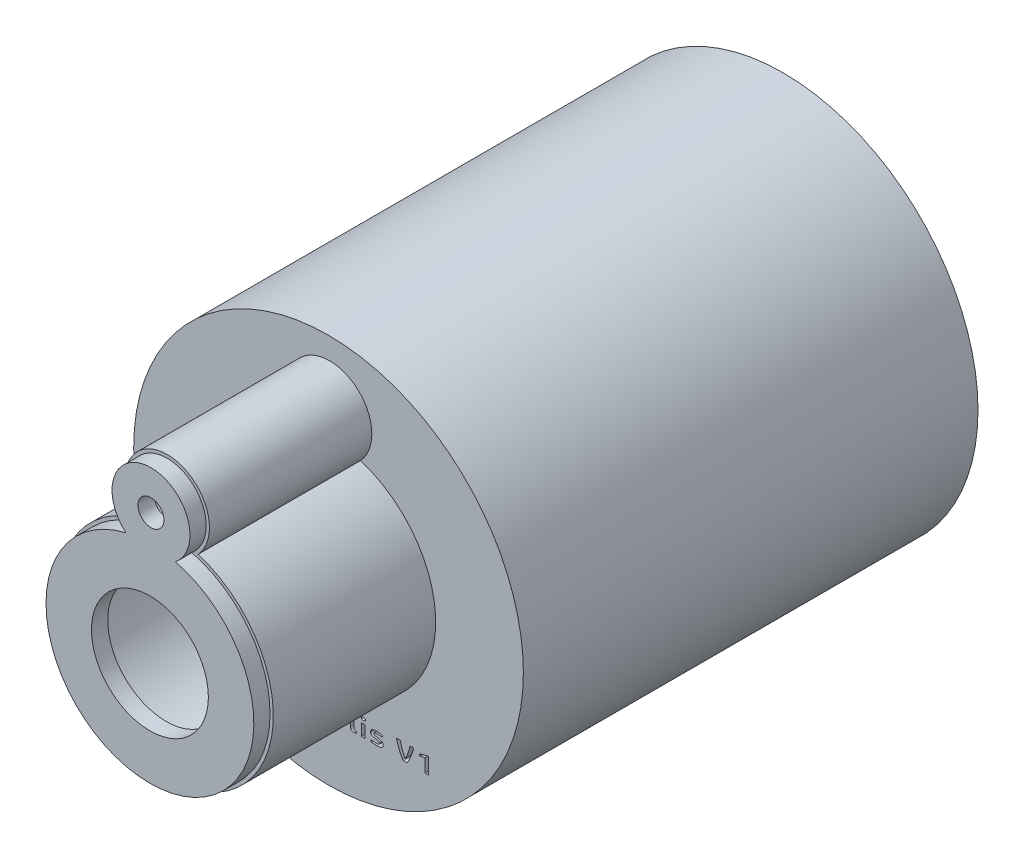
from build123d import *

# Parameters (mm, degrees)
SKETCH4_R           = 60
BOSS_EXTRUDE1_DEPTH = 140
SKETCH5_R           = 13
SKETCH5_R_2         = 33
BOSS_EXTRUDE2_DEPTH = 50
SKETCH6_R           = 28
SKETCH6_R_2         = 8
CUT_EXTRUDE1_DEPTH  = 60
SKETCH7_R           = 50
CUT_EXTRUDE2_DEPTH  = 130
SKETCH12_R          = 32
BOSS_EXTRUDE4_DEPTH = 5
SKETCH9_R           = 12
BOSS_EXTRUDE5_DEPTH = 5
SKETCH13_R          = 18
CUT_EXTRUDE5_DEPTH  = 5
SKETCH14_R          = 4
CUT_EXTRUDE6_DEPTH  = 5
CUT_EXTRUDE7_DEPTH  = 2


with BuildPart() as part:
    # Sketch4 → Boss-Extrude1 (new body)
    with BuildSketch(Plane.XY):
        Circle(SKETCH4_R)
    extrude(amount=BOSS_EXTRUDE1_DEPTH)

    # Sketch5 → Boss-Extrude2 (add)
    with BuildSketch(Plane.XY.offset(140)):
        with Locations((0.33083591, 40.361628263)):
            Circle(SKETCH5_R)
        Circle(SKETCH5_R_2)
    extrude(amount=BOSS_EXTRUDE2_DEPTH)

    # Sketch6 → Cut-Extrude1 (cut)
    with BuildSketch(Plane.XY.offset(190)):
        Circle(SKETCH6_R)
        with Locations((0.33083591, 40.361628263)):
            Circle(SKETCH6_R_2)
    extrude(amount=-CUT_EXTRUDE1_DEPTH, mode=Mode.SUBTRACT)

    # Sketch7 → Cut-Extrude2 (cut)
    with BuildSketch(Plane(origin=(0, 0, 0), x_dir=(-1, 0, 0), z_dir=(0, 0, -1))):
        Circle(SKETCH7_R)
    extrude(amount=-CUT_EXTRUDE2_DEPTH, mode=Mode.SUBTRACT)

    # Sketch12 → Boss-Extrude4 (add)
    with BuildSketch(Plane.XY.offset(190)):
        Circle(SKETCH12_R)
    extrude(amount=BOSS_EXTRUDE4_DEPTH)

    # Sketch9 → Boss-Extrude5 (add)
    with BuildSketch(Plane.XY.offset(190)):
        with Locations((0.33083591, 40.361628263)):
            Circle(SKETCH9_R)
    extrude(amount=BOSS_EXTRUDE5_DEPTH)

    # Sketch13 → Cut-Extrude5 (cut)
    with BuildSketch(Plane.XY.offset(195)):
        Circle(SKETCH13_R)
    extrude(amount=-CUT_EXTRUDE5_DEPTH, mode=Mode.SUBTRACT)

    # Sketch14 → Cut-Extrude6 (cut)
    with BuildSketch(Plane.XY.offset(195)):
        with Locations((0.33083591, 40.361628263)):
            Circle(SKETCH14_R)
    extrude(amount=-CUT_EXTRUDE6_DEPTH, mode=Mode.SUBTRACT)

    # Sketch16 → Cut-Extrude7 (cut)
    # profile 1 of 12: a face of its own
    with BuildSketch(Plane.XY.offset(140)):
        with BuildLine():
            add(Edge.make_bspline(
                [(-26.977548413, -41.768014092), (-27.004355078, -41.662346657), (-27.056820118, -41.455538157), (-27.136325446, -41.149433204), (-27.21661879, -40.848068998), (-27.276331675, -40.649332315), (-27.306430168, -40.549158376)],
                knots=[0, 0, 0, 0, 1.036109552, 2.027836293, 3.005923811, 4, 4, 4, 4], degree=3))
            Line((-27.306430168, -40.549158376), (-29.681355084, -40.549158376))
            add(Edge.make_bspline(
                [(-29.681355084, -40.549158376), (-29.717752692, -40.664179316), (-29.790598663, -40.89438159), (-29.884113891, -41.242769528), (-29.965598567, -41.58970764), (-30.016153472, -41.819777816), (-30.041131791, -41.933451581)],
                knots=[0, 0, 0, 0, 1.011604593, 2.024619837, 3.023998219, 4, 4, 4, 4], degree=3))
            Line((-30.041131791, -41.933451581), (-30.86433279, -41.933451581))
            add(Edge.make_bspline(
                [(-30.86433279, -41.933451581), (-30.882633247, -41.932848293), (-30.917101282, -41.931712028), (-30.965211055, -41.924215889), (-31.006144996, -41.910654768), (-31.038868936, -41.890101627), (-31.065128061, -41.8648214), (-31.082405315, -41.832491039), (-31.091412068, -41.794746679), (-31.090855515, -41.768060084), (-31.090563573, -41.754061533)],
                knots=[0, 0, 0, 0, 1.31671978, 2.479978778, 3.493047105, 4.395117783, 5.240280982, 6.08544418, 6.995712803, 8, 8, 8, 8], degree=3))
            add(Edge.make_bspline(
                [(-31.090563573, -41.754061533), (-31.078220573, -41.683237062), (-31.053427092, -41.540971386), (-31.009150338, -41.403514519), (-30.98691599, -41.334488143)],
                knots=[0, 0, 0, 0, 0.995664919, 2, 2, 2, 2], degree=3))
            add(Edge.make_bspline(
                [(-30.98691599, -41.334488143), (-30.955509484, -41.219741306), (-30.893139564, -40.991866515), (-30.791837861, -40.655339145), (-30.682549099, -40.327011279), (-30.568659395, -40.006520433), (-30.447852996, -39.695629639), (-30.329361664, -39.392263782), (-30.207100434, -39.099296618), (-30.085192778, -38.815596664), (-29.96148004, -38.542532334), (-29.837606058, -38.280680151), (-29.711409254, -38.031271606), (-29.586143684, -37.793382268), (-29.462015392, -37.567883019), (-29.340018361, -37.355673515), (-29.222918777, -37.155819732), (-29.143774663, -37.028306793), (-29.105313707, -36.96634047)],
                knots=[0, 0, 0, 0, 1.196467633, 2.376055139, 3.534029074, 4.67641141, 5.796392693, 6.888350008, 7.951844138, 8.988948309, 9.993787566, 10.966691743, 11.902052304, 12.804745175, 13.670556874, 14.490675818, 15.266527234, 16, 16, 16, 16], degree=3))
            Line((-29.105313707, -36.96634047), (-28.035949697, -36.96634047))
            add(Edge.make_bspline(
                [(-28.035949697, -36.96634047), (-28.016659036, -36.966614809), (-27.979927665, -36.967137178), (-27.928387492, -36.97386889), (-27.883555407, -36.985516359), (-27.833968228, -37.008410666), (-27.780097383, -37.049999295), (-27.752253371, -37.095479866), (-27.737962895, -37.118822011)],
                knots=[0, 0, 0, 0, 0.977309512, 1.860896253, 2.628925488, 3.314632116, 4.621779657, 6, 6, 6, 6], degree=3))
            add(Edge.make_bspline(
                [(-27.737962895, -37.118822011), (-27.699137051, -37.182432943), (-27.618362241, -37.314771623), (-27.498147091, -37.524856269), (-27.371519583, -37.752389465), (-27.241728218, -37.998166047), (-27.10810073, -38.258957301), (-26.975813661, -38.535242761), (-26.844255496, -38.825804318), (-26.713186593, -39.129752406), (-26.583330583, -39.446368939), (-26.45813169, -39.7751607), (-26.336632385, -40.115110884), (-26.219132206, -40.464822581), (-26.108082556, -40.82319867), (-26.001939511, -41.187711923), (-25.904407651, -41.558364298), (-25.845215656, -41.808084665), (-25.815499546, -41.933451581)],
                knots=[0, 0, 0, 0, 0.687027572, 1.429319125, 2.231312766, 3.087608749, 3.991622935, 4.932713131, 5.911363029, 6.932026766, 7.984204277, 9.066060082, 10.175267671, 11.312299384, 12.466996594, 13.634008251, 14.812203049, 16, 16, 16, 16], degree=3))
            Line((-25.815499546, -41.933451581), (-26.720422678, -41.933451581))
            add(Edge.make_bspline(
                [(-26.720422678, -41.933451581), (-26.738384786, -41.932773665), (-26.772128687, -41.931500121), (-26.82012406, -41.924841147), (-26.862274678, -41.912486695), (-26.897565972, -41.89291216), (-26.927488962, -41.869863929), (-26.951140511, -41.841037063), (-26.968273438, -41.806557322), (-26.974391616, -41.781132529), (-26.977548413, -41.768014092)],
                knots=[0, 0, 0, 0, 1.283206404, 2.410651889, 3.453808489, 4.398707021, 5.276907899, 6.136645549, 7.038564488, 8, 8, 8, 8], degree=3))
        make_face()
        with BuildLine():
            add(Edge.make_bspline(
                [(-28.499373988, -37.587229359), (-28.542851355, -37.673459203), (-28.631348544, -37.848978084), (-28.760760988, -38.119290248), (-28.895047038, -38.398494981), (-29.030743022, -38.688003614), (-29.165576343, -38.988956037), (-29.297414446, -39.302074785), (-29.424529244, -39.628166639), (-29.506314314, -39.850398379), (-29.547809159, -39.963150886)],
                knots=[0, 0, 0, 0, 0.891837188, 1.815314257, 2.767664298, 3.753146242, 4.768046677, 5.813064396, 6.8904264, 8, 8, 8, 8], degree=3))
            Line((-29.547809159, -39.963150886), (-27.439976093, -39.963150886))
            add(Edge.make_bspline(
                [(-27.439976093, -39.963150886), (-27.480957173, -39.850328763), (-27.561809347, -39.627740346), (-27.690689933, -39.302330089), (-27.822088537, -38.988906566), (-27.957167924, -38.688061886), (-28.092490092, -38.398056096), (-28.228830989, -38.118868769), (-28.362296398, -37.848711686), (-28.454185587, -37.673428484), (-28.499373988, -37.587229359)],
                knots=[0, 0, 0, 0, 1.106420979, 2.182874149, 3.225923958, 4.238913199, 5.222539347, 6.175755827, 7.10289036, 8, 8, 8, 8], degree=3))
        make_face(mode=Mode.SUBTRACT)
    # profile 2 of 12: a face of its own
    with BuildSketch(Plane.XY.offset(140)):
        with BuildLine():
            add(Edge.make_bspline(
                [(-22.508543669, -41.974312648), (-22.587312936, -41.972941393), (-22.739470873, -41.970292552), (-22.959463513, -41.950967058), (-23.162646705, -41.915953869), (-23.349776141, -41.86841674), (-23.520985891, -41.808516339), (-23.675176884, -41.733184788), (-23.812947091, -41.64410664), (-23.935146765, -41.540746758), (-24.040663253, -41.42139627), (-24.131952103, -41.287273714), (-24.209924168, -41.138272893), (-24.272518205, -40.97317486), (-24.321128074, -40.792860187), (-24.355405034, -40.596741067), (-24.376502931, -40.385179856), (-24.378928358, -40.238931531), (-24.380179838, -40.163469773)],
                knots=[0, 0, 0, 0, 1.256153484, 2.426501229, 3.517846064, 4.54067307, 5.502532903, 6.405264093, 7.270788459, 8.112640372, 8.949459469, 9.803229658, 10.694240735, 11.625001681, 12.613329167, 13.668146633, 14.796801559, 16, 16, 16, 16], degree=3))
            add(Edge.make_bspline(
                [(-24.380179838, -40.163469773), (-24.379434394, -40.1172896), (-24.377980216, -40.027203477), (-24.371624446, -39.894777934), (-24.357931472, -39.768577244), (-24.342127964, -39.647904998), (-24.318322375, -39.534099108), (-24.292134072, -39.42561315), (-24.258986119, -39.323691338), (-24.210447888, -39.196028169), (-24.134840525, -39.048441748), (-24.02241063, -38.888149764), (-23.888422276, -38.747048697), (-23.73261798, -38.625745107), (-23.557097155, -38.521747445), (-23.360986691, -38.436340443), (-23.145532795, -38.367668637), (-22.909713288, -38.316853501), (-22.653188623, -38.279784029), (-22.374762665, -38.253718019), (-22.073915753, -38.236062364), (-21.865756596, -38.234722915), (-21.758095301, -38.234030144)],
                knots=[0, 0, 0, 0, 0.733315062, 1.43051673, 2.103868235, 2.748341019, 3.361740375, 3.948909084, 4.519376032, 5.06202641, 6.116448722, 7.142252151, 8.160761564, 9.193753651, 10.267470559, 11.39156558, 12.582533735, 13.852004473, 15.217050358, 16.695488148, 18.290884566, 20, 20, 20, 20], degree=3))
            add(Edge.make_bspline(
                [(-21.758095301, -38.234030144), (-21.686666324, -38.234396945), (-21.541791127, -38.235140908), (-21.321541116, -38.241858612), (-21.094890037, -38.250063739), (-20.866053289, -38.264505665), (-20.643506793, -38.280238822), (-20.435811873, -38.295790407), (-20.247474234, -38.312821213), (-20.128293515, -38.324953494), (-20.071828848, -38.330701448)],
                knots=[0, 0, 0, 0, 1.014509705, 2.05767043, 3.129599097, 4.235689714, 5.31414102, 6.29847709, 7.193863539, 8, 8, 8, 8], degree=3))
            add(Edge.make_bspline(
                [(-20.071828848, -38.330701448), (-20.039573138, -38.334437669), (-19.979213589, -38.341429195), (-19.895230025, -38.354889394), (-19.824146772, -38.371629197), (-19.765267303, -38.390712394), (-19.716814039, -38.416193421), (-19.683112241, -38.456018339), (-19.662423374, -38.50692474), (-19.660991121, -38.544756933), (-19.660228349, -38.564905122)],
                knots=[0, 0, 0, 0, 1.47150986, 2.753610701, 3.852760518, 4.776433191, 5.558881361, 6.295367601, 7.092168548, 8, 8, 8, 8], degree=3))
            Line((-19.660228349, -38.564905122), (-19.660228349, -38.87485126))
            Line((-19.660228349, -38.87485126), (-20.071828848, -38.87485126))
            add(Edge.make_bspline(
                [(-20.071828848, -38.87485126), (-20.062345919, -39.017656226), (-20.04336959, -39.303423823), (-20.030193874, -39.73120083), (-20.022042508, -40.153137397), (-20.020677121, -40.431886202), (-20.020005057, -40.569090604)],
                knots=[0, 0, 0, 0, 1.012937877, 2.026994097, 3.028856483, 4, 4, 4, 4], degree=3))
            Line((-20.020005057, -40.569090604), (-20.020005057, -43.152307297))
            Line((-20.020005057, -43.152307297), (-20.843206055, -43.152307297))
            add(Edge.make_bspline(
                [(-20.843206055, -43.152307297), (-20.877691804, -43.150557866), (-20.941913846, -43.147299938), (-21.01582337, -43.119534128), (-21.059986374, -43.086177205), (-21.083492261, -43.057279113), (-21.097236883, -43.023504479), (-21.099282783, -42.999945817), (-21.100331791, -42.98786642)],
                knots=[0, 0, 0, 0, 1.827935529, 3.404123575, 4.095951275, 4.749113857, 5.358624418, 6, 6, 6, 6], degree=3))
            Line((-21.100331791, -42.98786642), (-21.100331791, -41.671342789))
            add(Edge.make_bspline(
                [(-21.100331791, -41.671342789), (-21.147345703, -41.69166505), (-21.242619223, -41.732848037), (-21.390148171, -41.788043142), (-21.543123694, -41.840338107), (-21.703896694, -41.888174174), (-21.878315351, -41.928225284), (-22.070634487, -41.955268406), (-22.283053517, -41.970743956), (-22.431113025, -41.973087201), (-22.508543669, -41.974312648)],
                knots=[0, 0, 0, 0, 0.845953226, 1.714321087, 2.601099196, 3.516221763, 4.484057562, 5.554262304, 6.720953167, 8, 8, 8, 8], degree=3))
        make_face()
        with BuildLine():
            add(Edge.make_bspline(
                [(-21.100331791, -38.827013914), (-21.154458541, -38.82293473), (-21.268916901, -38.814308741), (-21.443146122, -38.809867431), (-21.615235006, -38.806778498), (-21.726866387, -38.806305892), (-21.77902414, -38.806085075)],
                knots=[0, 0, 0, 0, 0.958892077, 2.027707481, 3.078481825, 4, 4, 4, 4], degree=3))
            add(Edge.make_bspline(
                [(-21.77902414, -38.806085075), (-21.843479458, -38.806642186), (-21.96714266, -38.807711053), (-22.145752449, -38.816270639), (-22.309245482, -38.832574864), (-22.45901013, -38.852326524), (-22.595664581, -38.881629809), (-22.719837587, -38.924072793), (-22.831605901, -38.980460387), (-22.931556118, -39.04870867), (-23.019995292, -39.13016094), (-23.094007305, -39.227969224), (-23.157379974, -39.339270191), (-23.207080719, -39.466954339), (-23.244629942, -39.611162816), (-23.270524156, -39.77370272), (-23.287971352, -39.955132298), (-23.289228499, -40.082698362), (-23.28988699, -40.149517214)],
                knots=[0, 0, 0, 0, 1.292525523, 2.479823989, 3.584161294, 4.586565476, 5.507833927, 6.382143215, 7.210367728, 8.010466102, 8.802340966, 9.609810113, 10.460058896, 11.363107172, 12.348792099, 13.442874679, 14.660582827, 16, 16, 16, 16], degree=3))
            add(Edge.make_bspline(
                [(-23.28988699, -40.149517214), (-23.289283151, -40.206684812), (-23.288122897, -40.316530044), (-23.274914776, -40.473946519), (-23.254561115, -40.616869349), (-23.225910127, -40.745657747), (-23.188731315, -40.860862395), (-23.145782533, -40.964437588), (-23.092956249, -41.054648098), (-23.035172155, -41.135006888), (-22.967425232, -41.20466879), (-22.887179098, -41.261001846), (-22.797823067, -41.309654891), (-22.696973815, -41.347011388), (-22.58639505, -41.375699623), (-22.465858536, -41.39473371), (-22.336445415, -41.408497244), (-22.24680725, -41.409640933), (-22.200590753, -41.410230608)],
                knots=[0, 0, 0, 0, 1.412984842, 2.714993322, 3.90202106, 4.979903167, 5.972056552, 6.891927663, 7.745585704, 8.550482747, 9.334494065, 10.13455811, 10.965026881, 11.843605382, 12.785825972, 13.784957136, 14.857947166, 16, 16, 16, 16], degree=3))
            add(Edge.make_bspline(
                [(-22.200590753, -41.410230608), (-22.145417755, -41.409218833), (-22.037548847, -41.40724071), (-21.879997977, -41.393437537), (-21.730837806, -41.369524024), (-21.590289621, -41.336366298), (-21.457499249, -41.296601969), (-21.331519672, -41.25565952), (-21.213146454, -41.210216089), (-21.137444999, -41.177911797), (-21.100331791, -41.162074374)],
                knots=[0, 0, 0, 0, 1.16488758, 2.277475471, 3.336064214, 4.351794088, 5.323965158, 6.262219519, 7.148040045, 8, 8, 8, 8], degree=3))
            Line((-21.100331791, -41.162074374), (-21.100331791, -38.827013914))
        make_face(mode=Mode.SUBTRACT)
    # profile 3 of 12: a face of its own
    with BuildSketch(Plane.XY.offset(140)):
        with BuildLine():
            add(Edge.make_bspline(
                [(-13.999276396, -38.289840381), (-13.979338582, -38.290575792), (-13.941658252, -38.291965641), (-13.888835116, -38.297846921), (-13.843924217, -38.311233183), (-13.806546087, -38.32847245), (-13.776911342, -38.352159502), (-13.756883323, -38.38184071), (-13.743962624, -38.4164026), (-13.742776411, -38.441200089), (-13.74215066, -38.454281259)],
                knots=[0, 0, 0, 0, 1.387638878, 2.622488663, 3.682252433, 4.632663527, 5.469644107, 6.283352712, 7.094434326, 8, 8, 8, 8], degree=3))
            Line((-13.74215066, -38.454281259), (-13.74215066, -41.933451581))
            Line((-13.74215066, -41.933451581), (-14.39991417, -41.933451581))
            add(Edge.make_bspline(
                [(-14.39991417, -41.933451581), (-14.435202467, -41.931582534), (-14.501795235, -41.928055443), (-14.581698056, -41.909230603), (-14.634754081, -41.879287185), (-14.665085116, -41.846100928), (-14.687828002, -41.803640212), (-14.695053709, -41.771277563), (-14.698897584, -41.754061533)],
                knots=[0, 0, 0, 0, 1.648986663, 3.111813202, 3.779064143, 4.458978198, 5.180219246, 6, 6, 6, 6], degree=3))
            Line((-14.698897584, -41.754061533), (-14.73975865, -41.533810418))
            add(Edge.make_bspline(
                [(-14.73975865, -41.533810418), (-14.796539184, -41.572149984), (-14.910871066, -41.649349587), (-15.096715049, -41.745383024), (-15.293433652, -41.827233451), (-15.501804689, -41.894097996), (-15.721458918, -41.945775935), (-15.95268637, -41.981943145), (-16.195299667, -42.005985008), (-16.36118518, -42.008108753), (-16.445957331, -42.009194046)],
                knots=[0, 0, 0, 0, 0.912873642, 1.838139873, 2.783325984, 3.751279561, 4.752619747, 5.788875424, 6.870053321, 8, 8, 8, 8], degree=3))
            add(Edge.make_bspline(
                [(-16.445957331, -42.009194046), (-16.515758208, -42.008070641), (-16.6502625, -42.005905871), (-16.844675852, -41.988717471), (-17.0242853, -41.961435509), (-17.188991082, -41.922900581), (-17.338321411, -41.87401926), (-17.472722557, -41.816471408), (-17.591858923, -41.749886884), (-17.696136102, -41.67449774), (-17.786144861, -41.58963081), (-17.863184532, -41.495300917), (-17.928729859, -41.391680873), (-17.981275696, -41.278615768), (-18.021769753, -41.158162306), (-18.050926442, -41.031340736), (-18.067818317, -40.898763174), (-18.070214553, -40.808324861), (-18.071430489, -40.762433211)],
                knots=[0, 0, 0, 0, 1.434555396, 2.764347141, 4.008246389, 5.165982417, 6.237023291, 7.234067552, 8.166592063, 9.036620823, 9.872287823, 10.702019296, 11.533687265, 12.385956256, 13.258339921, 14.141216526, 15.056786467, 16, 16, 16, 16], degree=3))
            Line((-18.071430489, -40.762433211), (-18.071430489, -38.289840381))
            Line((-18.071430489, -38.289840381), (-17.24822949, -38.289840381))
            add(Edge.make_bspline(
                [(-17.24822949, -38.289840381), (-17.22895354, -38.290575424), (-17.192263099, -38.291974527), (-17.140470036, -38.297977274), (-17.095846513, -38.311186025), (-17.058317115, -38.328716555), (-17.028310949, -38.352027578), (-17.006389973, -38.38109206), (-16.992877279, -38.415978951), (-16.991709368, -38.441201999), (-16.991103755, -38.454281259)],
                knots=[0, 0, 0, 0, 1.345977987, 2.561976077, 3.625276133, 4.578858618, 5.436666575, 6.247810334, 7.091412578, 8, 8, 8, 8], degree=3))
            Line((-16.991103755, -38.454281259), (-16.991103755, -40.707619586))
            add(Edge.make_bspline(
                [(-16.991103755, -40.707619586), (-16.990336247, -40.737557256), (-16.988855441, -40.795318058), (-16.977580875, -40.878717771), (-16.960270704, -40.955831873), (-16.934135104, -41.026569503), (-16.900068903, -41.090220103), (-16.859818446, -41.148293563), (-16.811665473, -41.199593698), (-16.755075974, -41.243476999), (-16.691800417, -41.281144177), (-16.622444543, -41.314237283), (-16.546491835, -41.342351423), (-16.463127196, -41.36354421), (-16.373387102, -41.381697171), (-16.276860425, -41.394638369), (-16.173638793, -41.401115975), (-16.102798434, -41.402526545), (-16.066248395, -41.403254328)],
                knots=[0, 0, 0, 0, 1.083149525, 2.089794671, 3.040534326, 3.938332623, 4.809656776, 5.646884279, 6.48893238, 7.345195062, 8.22977362, 9.149365923, 10.1231649, 11.155544731, 12.259055495, 13.435725847, 14.676964388, 16, 16, 16, 16], degree=3))
            add(Edge.make_bspline(
                [(-16.066248395, -41.403254328), (-15.996420035, -41.40211016), (-15.861706145, -41.399902816), (-15.666985819, -41.377526099), (-15.487280449, -41.341616881), (-15.323702977, -41.289769422), (-15.17646179, -41.231337369), (-15.045907705, -41.170099999), (-14.931215151, -41.110787381), (-14.863986061, -41.06565122), (-14.832443509, -41.044474232)],
                knots=[0, 0, 0, 0, 1.283932131, 2.476980574, 3.599879669, 4.649350945, 5.62860652, 6.5116207, 7.301682026, 8, 8, 8, 8], degree=3))
            Line((-14.832443509, -41.044474232), (-14.832443509, -38.289840381))
            Line((-14.832443509, -38.289840381), (-13.999276396, -38.289840381))
        make_face()
    # profile 4 of 12: a face of its own
    with BuildSketch(Plane.XY.offset(140)):
        with BuildLine():
            add(Edge.make_bspline(
                [(-10.405296443, -41.995241487), (-10.472425508, -41.994251632), (-10.602516246, -41.992333374), (-10.790899013, -41.978577031), (-10.966099134, -41.955084946), (-11.127873185, -41.921079862), (-11.276950193, -41.879086284), (-11.412248862, -41.825873731), (-11.534920802, -41.76430681), (-11.644215988, -41.692634638), (-11.739255728, -41.610928822), (-11.822660641, -41.52317905), (-11.89377988, -41.427534798), (-11.949873324, -41.323297229), (-11.995813824, -41.212694761), (-12.027199299, -41.094394364), (-12.046762762, -40.968723675), (-12.048707666, -40.882434053), (-12.049705217, -40.838175676)],
                knots=[0, 0, 0, 0, 1.415225244, 2.742592874, 3.979751683, 5.139106783, 6.225279114, 7.241064896, 8.199553372, 9.114497009, 9.988893752, 10.836136541, 11.662628813, 12.493265413, 13.325671838, 14.181985237, 15.067531184, 16, 16, 16, 16], degree=3))
            add(Edge.make_bspline(
                [(-12.049705217, -40.838175676), (-12.047855242, -40.784224565), (-12.044286297, -40.680142899), (-12.015307857, -40.531542521), (-11.967204817, -40.397550577), (-11.899652711, -40.277618545), (-11.811659131, -40.172996793), (-11.710787508, -40.076687813), (-11.591249487, -39.994268867), (-11.457299839, -39.921931525), (-11.309258882, -39.85880586), (-11.147582669, -39.808450837), (-10.974175142, -39.764407991), (-10.788265896, -39.7342462), (-10.592726127, -39.710425916), (-10.388892762, -39.694063962), (-10.178208965, -39.682218069), (-10.035238855, -39.681482535), (-9.96280099, -39.681109866)],
                knots=[0, 0, 0, 0, 0.964341533, 1.860393058, 2.694903052, 3.501120679, 4.307513428, 5.131337508, 5.988488545, 6.89511447, 7.850796472, 8.861675751, 9.920815563, 11.048010517, 12.227123545, 13.443373774, 14.704648521, 16, 16, 16, 16], degree=3))
            Line((-9.96280099, -39.681109866), (-8.852575915, -39.681109866))
            Line((-8.852575915, -39.681109866), (-8.852575915, -39.439929912))
            add(Edge.make_bspline(
                [(-8.852575915, -39.439929912), (-8.853640342, -39.409991292), (-8.855685182, -39.352477118), (-8.868253888, -39.269555453), (-8.891251602, -39.194441294), (-8.923250084, -39.126163533), (-8.965866846, -39.066268441), (-9.016273321, -39.012231919), (-9.076622942, -38.966231607), (-9.147317943, -38.928263082), (-9.227815154, -38.895234257), (-9.320149579, -38.86801522), (-9.424228943, -38.843847241), (-9.54120532, -38.825627481), (-9.67021994, -38.810874766), (-9.81150625, -38.800141664), (-9.965050202, -38.792873553), (-10.071754576, -38.792386032), (-10.127241868, -38.792132516)],
                knots=[0, 0, 0, 0, 0.886009117, 1.702085191, 2.473175512, 3.203003481, 3.922901354, 4.639098966, 5.38224235, 6.156521205, 7.007146751, 7.95240487, 9.001528078, 10.16663201, 11.452930608, 12.84308558, 14.358374387, 16, 16, 16, 16], degree=3))
            add(Edge.make_bspline(
                [(-10.127241868, -38.792132516), (-10.203987581, -38.792397164), (-10.353526648, -38.792912832), (-10.571821885, -38.800316106), (-10.778187702, -38.810926573), (-10.941558795, -38.823679505), (-11.063372074, -38.834890053), (-11.144782686, -38.841603941), (-11.217800851, -38.848196452), (-11.28267459, -38.851534402), (-11.33943888, -38.85573697), (-11.38824517, -38.859258536), (-11.428823235, -38.859684975), (-11.453068519, -38.860528776), (-11.463697727, -38.860898701)],
                knots=[0, 0, 0, 0, 2.063697293, 4.02111535, 5.872942361, 7.620105495, 8.427283344, 9.162488045, 9.816826736, 10.398597475, 10.909054671, 11.347611884, 11.713991019, 12, 12, 12, 12], degree=3))
            add(Edge.make_bspline(
                [(-11.463697727, -38.860898701), (-11.485988492, -38.860427399), (-11.527130534, -38.859557518), (-11.583569974, -38.850928524), (-11.629444212, -38.836567618), (-11.665216755, -38.815591441), (-11.68898673, -38.788074246), (-11.708287369, -38.760243102), (-11.718034455, -38.728273095), (-11.719887519, -38.706472324), (-11.720823462, -38.695461212)],
                knots=[0, 0, 0, 0, 1.552178229, 2.864853768, 3.962653502, 4.887531227, 5.706437177, 6.476811399, 7.23066941, 8, 8, 8, 8], degree=3))
            Line((-11.720823462, -38.695461212), (-11.720823462, -38.385515073))
            add(Edge.make_bspline(
                [(-11.720823462, -38.385515073), (-11.657086502, -38.373305449), (-11.525548945, -38.34810776), (-11.321625314, -38.314153742), (-11.104535609, -38.284582042), (-10.796625075, -38.248583231), (-10.397381856, -38.214129841), (-10.074174244, -38.209473009), (-9.910977199, -38.207121637)],
                knots=[0, 0, 0, 0, 0.641341526, 1.323572645, 2.042783159, 2.806344037, 4.387429025, 6, 6, 6, 6], degree=3))
            add(Edge.make_bspline(
                [(-9.910977199, -38.207121637), (-9.814291455, -38.208414966), (-9.628753795, -38.210896835), (-9.362811413, -38.225549603), (-9.122016865, -38.254739716), (-8.905218733, -38.293076511), (-8.710615799, -38.341749819), (-8.536277571, -38.400000955), (-8.38204465, -38.468716572), (-8.246593902, -38.546255787), (-8.131390652, -38.634792806), (-8.032561515, -38.730594848), (-7.954211365, -38.837933143), (-7.893070153, -38.953317344), (-7.848733009, -39.075848164), (-7.816986114, -39.203464334), (-7.79591018, -39.336580979), (-7.794098964, -39.427556541), (-7.793178019, -39.473814699)],
                knots=[0, 0, 0, 0, 1.659603158, 3.184739299, 4.568808194, 5.820331222, 6.961236876, 8.008849904, 8.971051529, 9.855120606, 10.680793122, 11.458949908, 12.209350059, 12.951604098, 13.693047373, 14.43982107, 15.206699015, 16, 16, 16, 16], degree=3))
            Line((-7.793178019, -39.473814699), (-7.793178019, -41.933451581))
            Line((-7.793178019, -41.933451581), (-8.450941529, -41.933451581))
            add(Edge.make_bspline(
                [(-8.450941529, -41.933451581), (-8.478933773, -41.933287371), (-8.529209096, -41.932992443), (-8.595315196, -41.921825443), (-8.645995602, -41.907252476), (-8.687671615, -41.873203072), (-8.715974462, -41.819859788), (-8.731246414, -41.776146612), (-8.738962217, -41.754061533)],
                knots=[0, 0, 0, 0, 1.327174515, 2.383664775, 3.187696543, 3.794314314, 4.885627923, 6, 6, 6, 6], degree=3))
            Line((-8.738962217, -41.754061533), (-8.779823284, -41.540786698))
            add(Edge.make_bspline(
                [(-8.779823284, -41.540786698), (-8.828306352, -41.570303343), (-8.92781934, -41.630887163), (-9.088451701, -41.712498713), (-9.263086769, -41.788535084), (-9.451703064, -41.862002385), (-9.659628862, -41.922619872), (-9.889006205, -41.964313199), (-10.139927089, -41.990431084), (-10.31453562, -41.993596247), (-10.405296443, -41.995241487)],
                knots=[0, 0, 0, 0, 0.795389131, 1.632560643, 2.522825737, 3.464585412, 4.468137864, 5.553093082, 6.728107483, 8, 8, 8, 8], degree=3))
        make_face()
        with BuildLine():
            add(Edge.make_bspline(
                [(-9.993695943, -40.19037828), (-10.044532771, -40.190941203), (-10.141974022, -40.192020182), (-10.281456592, -40.200416203), (-10.407470207, -40.216649305), (-10.520388302, -40.237118526), (-10.621082039, -40.262901709), (-10.710199885, -40.294073357), (-10.789083838, -40.328111929), (-10.856789135, -40.367496732), (-10.914904844, -40.410479123), (-10.962459609, -40.459005246), (-11.003632407, -40.50953201), (-11.043069186, -40.584334382), (-11.077173147, -40.686897948), (-11.081679417, -40.773080162), (-11.083988791, -40.817246837)],
                knots=[0, 0, 0, 0, 1.50627037, 2.887136613, 4.137315439, 5.268619748, 6.285646355, 7.213294791, 8.0637903, 8.826861862, 9.529655705, 10.197821543, 10.83579759, 11.452460549, 12.694436549, 14, 14, 14, 14], degree=3))
            add(Edge.make_bspline(
                [(-11.083988791, -40.817246837), (-11.083186867, -40.843861922), (-11.081626044, -40.895664124), (-11.070671226, -40.970199518), (-11.052842832, -41.039290685), (-11.026743282, -41.102711167), (-10.992957326, -41.160237626), (-10.952228634, -41.212350318), (-10.904098302, -41.258599303), (-10.847507869, -41.298227597), (-10.784115586, -41.333464754), (-10.712862703, -41.363265562), (-10.633618657, -41.387743498), (-10.547133708, -41.408771183), (-10.452804182, -41.424252526), (-10.351080334, -41.436349089), (-10.241616271, -41.443247128), (-10.166119138, -41.44382026), (-10.127241868, -41.444115394)],
                knots=[0, 0, 0, 0, 0.979404985, 1.906262432, 2.766354571, 3.599696036, 4.421748149, 5.214261292, 6.027169049, 6.868633899, 7.749847325, 8.692300776, 9.7054701, 10.799795276, 11.965691367, 13.221476084, 14.569198335, 16, 16, 16, 16], degree=3))
            add(Edge.make_bspline(
                [(-10.127241868, -41.444115394), (-10.059076964, -41.442899805), (-9.927056821, -41.440545481), (-9.736173689, -41.418967465), (-9.55851638, -41.386000733), (-9.394529044, -41.337564225), (-9.243497012, -41.278764636), (-9.102670084, -41.217258821), (-8.972493074, -41.152006006), (-8.891815698, -41.103128583), (-8.852575915, -41.07935563)],
                knots=[0, 0, 0, 0, 1.216458552, 2.356007602, 3.424894738, 4.438296932, 5.40312733, 6.316595723, 7.181227486, 8, 8, 8, 8], degree=3))
            Line((-8.852575915, -41.07935563), (-8.852575915, -40.19037828))
            Line((-8.852575915, -40.19037828), (-9.993695943, -40.19037828))
        make_face(mode=Mode.SUBTRACT)
    # profile 5 of 12: a face of its own
    with BuildSketch(Plane.XY.offset(140)):
        with BuildLine():
            add(Edge.make_bspline(
                [(-5.533660701, -41.933451581), (-5.55360872, -41.932735791), (-5.591308336, -41.931383023), (-5.644005019, -41.925258613), (-5.689165496, -41.912664447), (-5.725436815, -41.893060649), (-5.755639761, -41.870642526), (-5.776561701, -41.841029456), (-5.788768663, -41.806137432), (-5.790095342, -41.78107148), (-5.790786437, -41.768014092)],
                knots=[0, 0, 0, 0, 1.385793371, 2.619000853, 3.677355178, 4.616356692, 5.470174724, 6.263919518, 7.095638694, 8, 8, 8, 8], degree=3))
            Line((-5.790786437, -41.768014092), (-5.790786437, -37.056035494))
            add(Edge.make_bspline(
                [(-5.790786437, -37.056035494), (-5.709442561, -37.045661057), (-5.542643003, -37.024387771), (-5.28463263, -36.999535431), (-5.01298857, -36.974814783), (-4.730474613, -36.956045929), (-4.445814934, -36.938739938), (-4.166057281, -36.9268703), (-3.895604702, -36.919509957), (-3.718171456, -36.918834485), (-3.63112958, -36.918503124)],
                knots=[0, 0, 0, 0, 0.908825203, 1.863590105, 2.872650169, 3.93194401, 5.001554155, 6.033457691, 7.035290539, 8, 8, 8, 8], degree=3))
            add(Edge.make_bspline(
                [(-3.63112958, -36.918503124), (-3.526800906, -36.919717243), (-3.32497503, -36.922065979), (-3.032845372, -36.938141359), (-2.762628904, -36.968702427), (-2.513278235, -37.006994019), (-2.285972602, -37.060017063), (-2.079571039, -37.122898799), (-1.894801222, -37.198594486), (-1.730701307, -37.286486068), (-1.585644903, -37.387317284), (-1.461621744, -37.505776355), (-1.356253125, -37.639258027), (-1.269345268, -37.788314781), (-1.204074162, -37.953935522), (-1.155938679, -38.1343952), (-1.128504102, -38.330863239), (-1.124648793, -38.466820738), (-1.12265874, -38.537000003)],
                knots=[0, 0, 0, 0, 1.467446551, 2.838804297, 4.112798851, 5.2911788, 6.384923374, 7.392850728, 8.323050796, 9.188581975, 10.006610808, 10.799815529, 11.591587676, 12.391398325, 13.217421591, 14.087870208, 15.012986662, 16, 16, 16, 16], degree=3))
            add(Edge.make_bspline(
                [(-1.12265874, -38.537000003), (-1.124334538, -38.608875556), (-1.127563534, -38.747368314), (-1.158875935, -38.946526202), (-1.210266565, -39.128172245), (-1.282232751, -39.292748762), (-1.37508146, -39.439307604), (-1.481534627, -39.573679857), (-1.607773318, -39.691341493), (-1.749390387, -39.795976823), (-1.908364057, -39.885734921), (-2.08373185, -39.961849124), (-2.275081913, -40.027455247), (-2.482976452, -40.076593111), (-2.704359147, -40.115240979), (-2.937929095, -40.142768841), (-3.183059977, -40.159996262), (-3.350388211, -40.16229598), (-3.435793749, -40.163469773)],
                knots=[0, 0, 0, 0, 1.071898142, 2.065377227, 2.998921298, 3.882259931, 4.735082508, 5.58126632, 6.433397069, 7.301923041, 8.203312633, 9.15108119, 10.151228698, 11.217679689, 12.335026698, 13.503282054, 14.725657139, 16, 16, 16, 16], degree=3))
            add(Edge.make_bspline(
                [(-3.435793749, -40.163469773), (-3.531492191, -40.162221701), (-3.729023895, -40.159645549), (-4.033224281, -40.1409822), (-4.352578658, -40.109978635), (-4.569681645, -40.081396204), (-4.680561361, -40.066798469)],
                knots=[0, 0, 0, 0, 0.919068346, 1.897054254, 2.925975035, 4, 4, 4, 4], degree=3))
            Line((-4.680561361, -40.066798469), (-4.680561361, -41.933451581))
            Line((-4.680561361, -41.933451581), (-5.533660701, -41.933451581))
        make_face()
        with BuildLine():
            add(Edge.make_bspline(
                [(-4.680561361, -39.487767258), (-4.5879398, -39.500563152), (-4.403333219, -39.526067), (-4.12558775, -39.555275573), (-3.847653037, -39.574027919), (-3.662053703, -39.576318199), (-3.569339674, -39.577462282)],
                knots=[0, 0, 0, 0, 1.005515461, 2.004120519, 3.002981188, 4, 4, 4, 4], degree=3))
            add(Edge.make_bspline(
                [(-3.569339674, -39.577462282), (-3.514513941, -39.576918422), (-3.408107022, -39.575862886), (-3.25379992, -39.566901289), (-3.109797778, -39.552018509), (-2.975766432, -39.531803056), (-2.852319353, -39.503294711), (-2.739325725, -39.466467433), (-2.637602939, -39.420919669), (-2.546207935, -39.366577063), (-2.465392802, -39.302501538), (-2.39640765, -39.227313359), (-2.338765672, -39.141818769), (-2.291431024, -39.046111006), (-2.255547373, -38.937385538), (-2.23061175, -38.815980708), (-2.214092103, -38.680960298), (-2.212690596, -38.586552502), (-2.211954976, -38.537000003)],
                knots=[0, 0, 0, 0, 1.322607221, 2.566943458, 3.727272525, 4.814320414, 5.834931852, 6.780266477, 7.677028767, 8.518205277, 9.339288321, 10.156057483, 10.969635435, 11.819094358, 12.723878734, 13.723602391, 14.8051708, 16, 16, 16, 16], degree=3))
            add(Edge.make_bspline(
                [(-2.211954976, -38.537000003), (-2.21258557, -38.484778913), (-2.213786304, -38.38534292), (-2.231500678, -38.244403096), (-2.256693827, -38.11881874), (-2.296450164, -38.009104912), (-2.346394059, -37.912689277), (-2.409186155, -37.828382627), (-2.484892867, -37.756034459), (-2.572507823, -37.69527116), (-2.670414038, -37.644686255), (-2.777250035, -37.601268101), (-2.894862004, -37.569201164), (-3.021513598, -37.544406133), (-3.157177482, -37.527738333), (-3.300948417, -37.512632609), (-3.453355375, -37.506816752), (-3.557712258, -37.505292054), (-3.611197352, -37.504510615)],
                knots=[0, 0, 0, 0, 1.235056011, 2.351713088, 3.357205668, 4.260037661, 5.104124911, 5.918693086, 6.736140138, 7.571577405, 8.433242255, 9.339934786, 10.295751684, 11.313466575, 12.392106976, 13.529661538, 14.733899641, 16, 16, 16, 16], degree=3))
            add(Edge.make_bspline(
                [(-3.611197352, -37.504510615), (-3.714198478, -37.504764595), (-3.914616302, -37.505258784), (-4.160029506, -37.516203741), (-4.343522804, -37.524207119), (-4.46668143, -37.535050478), (-4.577807874, -37.545035179), (-4.647702124, -37.554754783), (-4.680561361, -37.559324241)],
                knots=[0, 0, 0, 0, 1.729998862, 3.366202114, 4.126138444, 4.814789918, 5.442799667, 6, 6, 6, 6], degree=3))
            Line((-4.680561361, -37.559324241), (-4.680561361, -39.487767258))
        make_face(mode=Mode.SUBTRACT)
    # profile 6 of 12: a face of its own
    with BuildSketch(Plane.XY.offset(140)):
        with BuildLine():
            add(Edge.make_bspline(
                [(2.737416452, -42.016170326), (2.639700151, -42.015044572), (2.451310122, -42.012874199), (2.179118674, -41.990346063), (1.927940071, -41.955516295), (1.697364738, -41.905691221), (1.487301397, -41.843089444), (1.298658854, -41.764012111), (1.130307063, -41.671604869), (0.983115159, -41.562712855), (0.854102558, -41.438541408), (0.744748105, -41.296831432), (0.650503277, -41.139603664), (0.575762171, -40.964886192), (0.514948729, -40.774203185), (0.47500444, -40.56642564), (0.447685757, -40.342589705), (0.445398251, -40.187811311), (0.44421367, -40.107659536)],
                knots=[0, 0, 0, 0, 1.360973887, 2.623860159, 3.801918776, 4.891185609, 5.907164993, 6.85089497, 7.735504845, 8.575940992, 9.394141964, 10.221751368, 11.062251221, 11.940958206, 12.863051048, 13.845071938, 14.884073515, 16, 16, 16, 16], degree=3))
            add(Edge.make_bspline(
                [(0.44421367, -40.107659536), (0.445437543, -40.027844997), (0.447810729, -39.873078387), (0.474769482, -39.649512051), (0.515174162, -39.441844925), (0.575435995, -39.251608773), (0.6511248, -39.077382003), (0.744070987, -38.919687702), (0.854504345, -38.778745487), (0.983055391, -38.654552092), (1.1303294, -38.545737993), (1.298631054, -38.453222099), (1.487487706, -38.374494292), (1.69715848, -38.310285563), (1.927973309, -38.260907202), (2.179108806, -38.225937611), (2.45131289, -38.203450464), (2.639701096, -38.201274178), (2.737416452, -38.200145357)],
                knots=[0, 0, 0, 0, 1.111795248, 2.155857635, 3.133777223, 4.056280005, 4.931136761, 5.775990452, 6.600322268, 7.418886991, 8.259696776, 9.144699926, 10.088849462, 11.106639891, 12.196390985, 13.374973338, 14.638421058, 16, 16, 16, 16], degree=3))
            add(Edge.make_bspline(
                [(2.737416452, -38.200145357), (2.834133622, -38.201296879), (3.021190908, -38.203523996), (3.291425707, -38.225833875), (3.541191416, -38.261048134), (3.770441972, -38.310078334), (3.978652594, -38.374712055), (4.166300729, -38.453153835), (4.333705619, -38.546030078), (4.48083886, -38.65451903), (4.609335936, -38.778764058), (4.719896843, -38.919645443), (4.812437862, -39.077654696), (4.889984753, -39.251149038), (4.948270054, -39.442094071), (4.98923127, -39.649467575), (5.016023379, -39.873090674), (5.018420363, -40.027849178), (5.019656509, -40.107659536)],
                knots=[0, 0, 0, 0, 1.351820669, 2.614508938, 3.787506755, 4.876057699, 5.888096099, 6.830857486, 7.714516587, 8.557901455, 9.378973135, 10.205829569, 11.053270729, 11.932685003, 12.856625196, 13.837539784, 14.884799741, 16, 16, 16, 16], degree=3))
            add(Edge.make_bspline(
                [(5.019656509, -40.107659536), (5.018459598, -40.187807118), (5.016148284, -40.342577417), (4.988995725, -40.56646984), (4.948493496, -40.773953644), (4.889659886, -40.965344795), (4.813062344, -41.139333784), (4.719219685, -41.296873479), (4.609737744, -41.438522875), (4.480779028, -41.562745832), (4.333727987, -41.671312896), (4.16627265, -41.764080108), (3.978840759, -41.842871931), (3.77023352, -41.905897711), (3.54122498, -41.955375386), (3.291415708, -41.990449684), (3.021193696, -42.012800645), (2.834134572, -42.015021857), (2.737416452, -42.016170326)],
                knots=[0, 0, 0, 0, 1.119344093, 2.161527691, 3.146556093, 4.070085663, 4.953352043, 5.79642599, 6.626570011, 7.447276784, 8.29028683, 9.17355321, 10.115895609, 11.126109349, 12.214176513, 13.386653019, 14.648780116, 16, 16, 16, 16], degree=3))
        make_face()
        with BuildLine():
            add(Edge.make_bspline(
                [(3.930360272, -40.107659536), (3.929300612, -40.045850023), (3.927275648, -39.927734684), (3.914890856, -39.758203682), (3.892343297, -39.604942162), (3.860697002, -39.466784999), (3.819557762, -39.343495761), (3.771329129, -39.232467256), (3.712149887, -39.135055575), (3.643800995, -39.050160642), (3.565512202, -38.977243958), (3.477878994, -38.914784231), (3.378364723, -38.866372456), (3.269823072, -38.827030215), (3.150890557, -38.799309202), (3.022118506, -38.777879273), (2.883128709, -38.766477022), (2.78693292, -38.764991873), (2.737416452, -38.764227397)],
                knots=[0, 0, 0, 0, 1.415724189, 2.70538844, 3.890119959, 4.960565705, 5.947055746, 6.863292744, 7.727136716, 8.549436677, 9.35152927, 10.170584319, 11.004246174, 11.877919177, 12.80984947, 13.796779548, 14.865899463, 16, 16, 16, 16], degree=3))
            add(Edge.make_bspline(
                [(2.737416452, -38.764227397), (2.686237657, -38.764970977), (2.587384741, -38.766407216), (2.444769769, -38.777954541), (2.313919577, -38.798962269), (2.194046791, -38.827054849), (2.085522813, -38.866383789), (1.98592586, -38.914719928), (1.898398139, -38.977626613), (1.818990852, -39.049471775), (1.751890101, -39.135468222), (1.692442788, -39.232394946), (1.64441159, -39.343533356), (1.602873844, -39.466635535), (1.57290268, -39.605106976), (1.549857054, -39.758175914), (1.537625426, -39.927742692), (1.535577955, -40.045852773), (1.534506518, -40.107659536)],
                knots=[0, 0, 0, 0, 1.166124408, 2.252393757, 3.256682799, 4.183837695, 5.053033823, 5.882423829, 6.697281876, 7.500810098, 8.314154879, 9.173572342, 10.085114359, 11.066549428, 12.129813792, 13.30847451, 14.591530264, 16, 16, 16, 16], degree=3))
            add(Edge.make_bspline(
                [(1.534506518, -40.107659536), (1.535586407, -40.170461535), (1.537651511, -40.290559644), (1.549773446, -40.462792418), (1.573055388, -40.618473109), (1.602755504, -40.759307897), (1.644237271, -40.884448043), (1.692433359, -40.996860092), (1.751959133, -41.094687782), (1.818412304, -41.1816527), (1.898224744, -41.252684128), (1.986088411, -41.313538234), (2.085462753, -41.360031107), (2.194126244, -41.396387265), (2.31418316, -41.420003941), (2.444960972, -41.437900247), (2.587413709, -41.448766575), (2.686238455, -41.450298396), (2.737416452, -41.451091674)],
                knots=[0, 0, 0, 0, 1.424255425, 2.723645479, 3.911514041, 4.991694393, 5.982691774, 6.896715699, 7.758425476, 8.573742981, 9.36829835, 10.170636173, 10.989391727, 11.846975703, 12.762984212, 13.759093467, 14.839510202, 16, 16, 16, 16], degree=3))
            add(Edge.make_bspline(
                [(2.737416452, -41.451091674), (2.7869325, -41.450279265), (2.883100276, -41.448701442), (3.021918951, -41.437966256), (3.150643181, -41.419708653), (3.269742366, -41.396407541), (3.378424829, -41.360043412), (3.477717383, -41.313474071), (3.565677897, -41.253062446), (3.644380506, -41.180964047), (3.712084974, -41.09510023), (3.771338068, -40.996787712), (3.819731471, -40.884485257), (3.860815327, -40.759161413), (3.892188821, -40.618634062), (3.914974816, -40.462765309), (3.927249466, -40.290567463), (3.929292122, -40.17046422), (3.930360272, -40.107659536)],
                knots=[0, 0, 0, 0, 1.128606263, 2.191926833, 3.170654762, 4.09136951, 4.953359553, 5.776321683, 6.582781731, 7.375836283, 8.200051443, 9.066188484, 9.984908451, 10.980997346, 12.068389509, 13.262361064, 14.568427082, 16, 16, 16, 16], degree=3))
        make_face(mode=Mode.SUBTRACT)
    # profile 7 of 12: a face of its own
    with BuildSketch(Plane.XY.offset(140)):
        with BuildLine():
            add(Edge.make_bspline(
                [(7.853221981, -41.086331909), (7.853970426, -41.11572896), (7.85534253, -41.169621788), (7.87465955, -41.242112925), (7.903730015, -41.300621339), (7.951041958, -41.341491624), (8.013611942, -41.366815239), (8.091129121, -41.385909699), (8.187412582, -41.398282236), (8.257477507, -41.401498798), (8.295717433, -41.403254328)],
                knots=[0, 0, 0, 0, 1.107886296, 2.03105842, 2.817968707, 3.538746267, 4.337101313, 5.348510502, 6.552874159, 8, 8, 8, 8], degree=3))
            add(Edge.make_bspline(
                [(8.295717433, -41.403254328), (8.322968075, -41.404734209), (8.373554144, -41.40748135), (8.4435209, -41.413883979), (8.501862512, -41.423835626), (8.549727669, -41.43572363), (8.588841899, -41.454550072), (8.616474132, -41.485898947), (8.632612443, -41.527765646), (8.633881851, -41.558903456), (8.634565302, -41.575668096)],
                knots=[0, 0, 0, 0, 1.517448381, 2.816878532, 3.904012722, 4.80475415, 5.556646155, 6.276073603, 7.071835607, 8, 8, 8, 8], degree=3))
            Line((8.634565302, -41.575668096), (8.634565302, -41.905546463))
            add(Edge.make_bspline(
                [(8.634565302, -41.905546463), (8.578191526, -41.916148232), (8.46227455, -41.937947817), (8.282199373, -41.959054823), (8.091951494, -41.972442487), (7.961877099, -41.973678114), (7.895079659, -41.974312648)],
                knots=[0, 0, 0, 0, 0.925063478, 1.902135487, 2.922678219, 4, 4, 4, 4], degree=3))
            add(Edge.make_bspline(
                [(7.895079659, -41.974312648), (7.841238405, -41.973680341), (7.738365467, -41.972472211), (7.592064137, -41.959873122), (7.461796065, -41.938063652), (7.346520278, -41.908962568), (7.245610126, -41.868849221), (7.154552039, -41.823551634), (7.074420625, -41.768154719), (7.003502538, -41.704996604), (6.943526169, -41.632508434), (6.892928535, -41.551878661), (6.853287169, -41.462064782), (6.82223515, -41.363789797), (6.801419757, -41.256637597), (6.785383188, -41.141205865), (6.77520831, -41.01674995), (6.774340305, -40.930548294), (6.773891858, -40.886013022)],
                knots=[0, 0, 0, 0, 1.415105156, 2.703800767, 3.855174213, 4.88457917, 5.821896056, 6.704532376, 7.552310161, 8.374701788, 9.193143049, 10.016970684, 10.869055124, 11.766641193, 12.720570459, 13.734487464, 14.829544348, 16, 16, 16, 16], degree=3))
            Line((6.773891858, -40.886013022), (6.773891858, -36.787947033))
            Line((6.773891858, -36.787947033), (7.60705897, -36.787947033))
            add(Edge.make_bspline(
                [(7.60705897, -36.787947033), (7.625027868, -36.788553061), (7.659164507, -36.789704369), (7.70754714, -36.797402946), (7.750217757, -36.81114704), (7.786003174, -36.831268579), (7.816220583, -36.855053642), (7.837106091, -36.884614967), (7.851452909, -36.917609259), (7.852623021, -36.941271979), (7.853221981, -36.953384522)],
                knots=[0, 0, 0, 0, 1.301606886, 2.47274402, 3.538223127, 4.529351312, 5.435296302, 6.297005869, 7.128266331, 8, 8, 8, 8], degree=3))
            Line((7.853221981, -36.953384522), (7.853221981, -41.086331909))
        make_face()
    # profile 8 of 12: a face of its own
    with BuildSketch(Plane.XY.offset(140)):
        with BuildLine():
            Line((11.283757668, -41.933451581), (10.451587167, -41.933451581))
            add(Edge.make_bspline(
                [(10.451587167, -41.933451581), (10.432299876, -41.932766622), (10.396245871, -41.931486218), (10.345561988, -41.925057116), (10.302064433, -41.912617127), (10.266800545, -41.893386796), (10.238387699, -41.870251253), (10.218767675, -41.840753253), (10.206394696, -41.806164127), (10.205101302, -41.781080624), (10.204427545, -41.768014092)],
                knots=[0, 0, 0, 0, 1.375111826, 2.570515989, 3.63414562, 4.577079929, 5.4168689, 6.218053494, 7.071746105, 8, 8, 8, 8], degree=3))
            Line((10.204427545, -41.768014092), (10.204427545, -38.289840381))
            Line((10.204427545, -38.289840381), (11.026631933, -38.289840381))
            add(Edge.make_bspline(
                [(11.026631933, -38.289840381), (11.046569747, -38.290575792), (11.084250077, -38.291965641), (11.137073213, -38.297846921), (11.181984112, -38.311233183), (11.219362242, -38.32847245), (11.248996987, -38.352159502), (11.269025006, -38.38184071), (11.281945705, -38.4164026), (11.283131917, -38.441200089), (11.283757668, -38.454281259)],
                knots=[0, 0, 0, 0, 1.387638878, 2.622488663, 3.682252433, 4.632663527, 5.469644107, 6.283352712, 7.094434326, 8, 8, 8, 8], degree=3))
            Line((11.283757668, -38.454281259), (11.283757668, -41.933451581))
        make_face()
    # profile 9 of 12: a face of its own
    with BuildSketch(Plane.XY.offset(140)):
        with BuildLine():
            add(Edge.make_bspline(
                [(10.738611244, -37.365981633), (10.68276689, -37.364831607), (10.579782426, -37.362710806), (10.437316797, -37.347825912), (10.32034618, -37.321182877), (10.225935107, -37.283179779), (10.155042087, -37.227867542), (10.105215209, -37.156910924), (10.07579997, -37.069822617), (10.07258687, -37.006776466), (10.070881621, -36.97331675)],
                knots=[0, 0, 0, 0, 1.517162111, 2.797849977, 3.883588359, 4.768818141, 5.539806533, 6.290996622, 7.093001442, 8, 8, 8, 8], degree=3))
            add(Edge.make_bspline(
                [(10.070881621, -36.97331675), (10.072689175, -36.941204367), (10.076143247, -36.879840525), (10.105145381, -36.794555323), (10.155645034, -36.724626853), (10.22592746, -36.668498665), (10.320110547, -36.628277757), (10.437110567, -36.599503516), (10.579734102, -36.583706368), (10.682763475, -36.581725571), (10.738611244, -36.580651867)],
                knots=[0, 0, 0, 0, 0.874741703, 1.671551819, 2.418509332, 3.198389045, 4.094695908, 5.189352393, 6.476469437, 8, 8, 8, 8], degree=3))
            add(Edge.make_bspline(
                [(10.738611244, -36.580651867), (10.791466396, -36.581782877), (10.890180048, -36.58389518), (11.02754436, -36.599446696), (11.142360349, -36.628882783), (11.236497828, -36.669048457), (11.309355276, -36.724173572), (11.362118036, -36.794148357), (11.39232324, -36.879677367), (11.395639221, -36.941186614), (11.397371366, -36.97331675)],
                knots=[0, 0, 0, 0, 1.460359876, 2.727406022, 3.809334803, 4.725401384, 5.536822016, 6.304115113, 7.114133026, 8, 8, 8, 8], degree=3))
            add(Edge.make_bspline(
                [(11.397371366, -36.97331675), (11.395744408, -37.006794808), (11.392673464, -37.069985896), (11.362057077, -37.157313882), (11.309959253, -37.22834707), (11.236501576, -37.282633124), (11.142148649, -37.320616958), (11.027328704, -37.347882753), (10.890131957, -37.362529383), (10.791463476, -37.364777447), (10.738611244, -37.365981633)],
                knots=[0, 0, 0, 0, 0.918491521, 1.733687168, 2.505081458, 3.307523155, 4.212363202, 5.28521337, 6.545811903, 8, 8, 8, 8], degree=3))
        make_face()
    # profile 10 of 12: a face of its own
    with BuildSketch(Plane.XY.offset(140)):
        with BuildLine():
            add(Edge.make_bspline(
                [(13.026033681, -41.341464422), (13.084165794, -41.345831696), (13.203734116, -41.35481447), (13.387782417, -41.367686628), (13.581463199, -41.380569756), (13.851036801, -41.398350673), (14.191237432, -41.413602907), (14.463794397, -41.416013736), (14.598686436, -41.417206887)],
                knots=[0, 0, 0, 0, 0.666294154, 1.370458925, 2.108715922, 2.884861439, 4.458276816, 6, 6, 6, 6], degree=3))
            add(Edge.make_bspline(
                [(14.598686436, -41.417206887), (14.654504188, -41.416884386), (14.761855379, -41.416264138), (14.915694483, -41.409933396), (15.055351287, -41.401612465), (15.180718453, -41.388689943), (15.291900688, -41.372257912), (15.389271844, -41.351725228), (15.472168869, -41.326848349), (15.542983188, -41.299413599), (15.601677763, -41.265128599), (15.653430843, -41.229103847), (15.695419524, -41.186101367), (15.73133673, -41.140156404), (15.758097477, -41.088271086), (15.778691552, -41.032199763), (15.789111077, -40.970773302), (15.790776817, -40.928566462), (15.791630256, -40.906941861)],
                knots=[0, 0, 0, 0, 1.848845117, 3.555781411, 5.099556601, 6.482506806, 7.729099489, 8.821240188, 9.775125302, 10.594554154, 11.328876635, 12.022231759, 12.675850904, 13.311911826, 13.946924792, 14.601284582, 15.283370615, 16, 16, 16, 16], degree=3))
            add(Edge.make_bspline(
                [(15.791630256, -40.906941861), (15.789593565, -40.870421345), (15.785746029, -40.801430007), (15.75519707, -40.720282861), (15.717023098, -40.665184691), (15.677379578, -40.627589207), (15.627951911, -40.5926008), (15.567886727, -40.561041267), (15.49784508, -40.529818205), (15.415558035, -40.501610521), (15.322228355, -40.473626824), (15.216556076, -40.448158834), (15.098197596, -40.42227826), (14.965723995, -40.395193074), (14.818073413, -40.368674813), (14.714640149, -40.351077965), (14.660476342, -40.34186321)],
                knots=[0, 0, 0, 0, 1.112533523, 2.10170018, 2.597063322, 3.149500518, 3.760420687, 4.441374979, 5.218080557, 6.100499921, 7.095580155, 8.193023359, 9.418900626, 10.795767014, 12.322073062, 14, 14, 14, 14], degree=3))
            add(Edge.make_bspline(
                [(14.660476342, -40.34186321), (14.541472566, -40.321022479), (14.31131917, -40.28071649), (14.03036766, -40.225555865), (13.820857023, -40.176727095), (13.678282616, -40.134121799), (13.547557928, -40.08520695), (13.428081684, -40.031756763), (13.32068531, -39.971629906), (13.227387593, -39.902165743), (13.146422044, -39.826332569), (13.079202159, -39.741142658), (13.025601138, -39.644723625), (12.991503936, -39.534383636), (12.966979174, -39.412436195), (12.965183413, -39.326457386), (12.964243775, -39.281468703)],
                knots=[0, 0, 0, 0, 2.29429831, 4.437174747, 5.436352322, 6.378390669, 7.260743439, 8.085149954, 8.862163189, 9.592713307, 10.288839453, 10.962772119, 11.646000847, 12.370176466, 13.147189701, 14, 14, 14, 14], degree=3))
            add(Edge.make_bspline(
                [(12.964243775, -39.281468703), (12.965773878, -39.234866273), (12.968744506, -39.144389677), (12.991696003, -39.013846023), (13.030680033, -38.893559727), (13.085896205, -38.784035219), (13.156695725, -38.68476474), (13.243658328, -38.596353741), (13.34609168, -38.518367179), (13.464255634, -38.45164229), (13.596446108, -38.394744004), (13.740916626, -38.343924291), (13.89846218, -38.301080921), (14.068962036, -38.266652105), (14.252625894, -38.239875207), (14.449238341, -38.221639043), (14.658655231, -38.209154136), (14.802640019, -38.207812237), (14.876741011, -38.207121637)],
                knots=[0, 0, 0, 0, 0.90515473, 1.757318621, 2.565646611, 3.35372143, 4.131096821, 4.9253333, 5.754173643, 6.624455525, 7.555120236, 8.547280872, 9.598016457, 10.724680959, 11.925094215, 13.202602362, 14.560334458, 16, 16, 16, 16], degree=3))
            add(Edge.make_bspline(
                [(14.876741011, -38.207121637), (14.938538797, -38.207413299), (15.068826924, -38.208028209), (15.270180151, -38.21666708), (15.479219624, -38.229000125), (15.685587218, -38.246680652), (15.881475028, -38.269041887), (16.061661751, -38.29127269), (16.219306074, -38.314101451), (16.314939893, -38.335213224), (16.357705519, -38.344654007)],
                knots=[0, 0, 0, 0, 0.995563648, 2.098944507, 3.246423155, 4.369170388, 5.435424178, 6.422579223, 7.294607415, 8, 8, 8, 8], degree=3))
            add(Edge.make_bspline(
                [(16.357705519, -38.344654007), (16.376721066, -38.350381471), (16.412159176, -38.361055394), (16.459830009, -38.379379356), (16.497942531, -38.39939571), (16.527290918, -38.421512466), (16.548487679, -38.4483482), (16.563910041, -38.47976721), (16.571103393, -38.517422867), (16.572328468, -38.543956536), (16.572973577, -38.557928842)],
                knots=[0, 0, 0, 0, 1.425398941, 2.65642864, 3.659389165, 4.508529655, 5.271981865, 6.093207066, 6.995906186, 8, 8, 8, 8], degree=3))
            Line((16.572973577, -38.557928842), (16.572973577, -38.867874981))
            add(Edge.make_bspline(
                [(16.572973577, -38.867874981), (16.49523647, -38.862580746), (16.344744824, -38.852331611), (16.12718768, -38.83717167), (15.925538234, -38.824207213), (15.739178071, -38.813081588), (15.565103819, -38.803992242), (15.400675644, -38.796748897), (15.244181133, -38.792559917), (15.14250633, -38.792272463), (15.09300568, -38.792132516)],
                knots=[0, 0, 0, 0, 1.261647227, 2.442429048, 3.531254093, 4.533513902, 5.465355766, 6.353704808, 7.198496784, 8, 8, 8, 8], degree=3))
            add(Edge.make_bspline(
                [(15.09300568, -38.792132516), (15.04350459, -38.792588153), (14.948462874, -38.793462972), (14.811832987, -38.798041151), (14.686883153, -38.807168036), (14.573508372, -38.818886102), (14.471602718, -38.833353157), (14.381592046, -38.851918226), (14.303337172, -38.874853625), (14.23593819, -38.900733039), (14.177556643, -38.929579915), (14.128745536, -38.963761543), (14.086897929, -39.000990854), (14.052647651, -39.042313804), (14.02521636, -39.08745422), (14.006145127, -39.13705186), (13.995134297, -39.190626351), (13.993556805, -39.227600178), (13.992746718, -39.246587305)],
                knots=[0, 0, 0, 0, 1.802517174, 3.46081921, 4.976775988, 6.363377614, 7.61047459, 8.723140725, 9.706819462, 10.576158507, 11.34975711, 12.071190028, 12.739232297, 13.383525709, 14.018324353, 14.654044331, 15.308812914, 16, 16, 16, 16], degree=3))
            add(Edge.make_bspline(
                [(13.992746718, -39.246587305), (13.993361778, -39.267589801), (13.994546465, -39.308043337), (14.007746721, -39.365354234), (14.029130929, -39.41650635), (14.058435469, -39.462411006), (14.097414985, -39.502768373), (14.145200134, -39.538626455), (14.20123511, -39.571685248), (14.26717407, -39.600206067), (14.342527927, -39.627081495), (14.428558399, -39.65253437), (14.525144375, -39.678613592), (14.632888752, -39.703336189), (14.751335433, -39.726814814), (14.879907866, -39.750737792), (15.018767156, -39.774746905), (15.114909839, -39.78987117), (15.164761699, -39.797713397)],
                knots=[0, 0, 0, 0, 0.718208493, 1.383362792, 2.000360976, 2.609441155, 3.237150649, 3.910717002, 4.650236673, 5.460020252, 6.366921457, 7.389100447, 8.531648106, 9.792879131, 11.174029346, 12.666875705, 14.271709914, 16, 16, 16, 16], degree=3))
            add(Edge.make_bspline(
                [(15.164761699, -39.797713397), (15.280479357, -39.818386982), (15.503825626, -39.858289), (15.776180302, -39.9152683), (15.979349195, -39.963997686), (16.118638103, -40.005704842), (16.247241975, -40.05381351), (16.36627979, -40.105726132), (16.473652776, -40.165327142), (16.568901023, -40.233609008), (16.651114246, -40.311433353), (16.720220593, -40.399407773), (16.775306237, -40.499005904), (16.8138385, -40.611926373), (16.836790261, -40.738255162), (16.839595518, -40.826778975), (16.841062038, -40.873057074)],
                knots=[0, 0, 0, 0, 2.241847226, 4.326981933, 5.305842788, 6.225848771, 7.097918384, 7.923280955, 8.700525478, 9.435591552, 10.15263341, 10.852248448, 11.561182788, 12.312587159, 13.117861551, 14, 14, 14, 14], degree=3))
            add(Edge.make_bspline(
                [(16.841062038, -40.873057074), (16.839461046, -40.924006587), (16.836370675, -41.02235372), (16.809197598, -41.163919934), (16.763201039, -41.292570208), (16.699427932, -41.409166968), (16.61872934, -41.513396106), (16.522402476, -41.607063958), (16.411010507, -41.691245443), (16.283918528, -41.76408597), (16.143713336, -41.828581235), (15.989589965, -41.880068655), (15.823435225, -41.924872778), (15.644533183, -41.956353778), (15.455187519, -41.979925152), (15.256665726, -41.996292075), (15.049297705, -42.008133853), (14.907986067, -42.008835845), (14.835879944, -42.009194046)],
                knots=[0, 0, 0, 0, 0.942656873, 1.819597393, 2.656159125, 3.462652104, 4.269660879, 5.087333686, 5.943494605, 6.847537974, 7.794319228, 8.796024192, 9.852268162, 10.977814086, 12.155699684, 13.384111961, 14.665208715, 16, 16, 16, 16], degree=3))
            add(Edge.make_bspline(
                [(14.835879944, -42.009194046), (14.76777528, -42.008393524), (14.625225456, -42.00671795), (14.405878494, -42.00017225), (14.178947013, -41.987086457), (13.953968819, -41.969638494), (13.739504608, -41.947078108), (13.570561087, -41.929071718), (13.448452224, -41.911446084), (13.370063051, -41.898350359), (13.302496026, -41.885865225), (13.261203587, -41.876122338), (13.24229835, -41.871661676)],
                knots=[0, 0, 0, 0, 1.275538221, 2.669828146, 4.109262085, 5.532171242, 6.895340939, 8.147836112, 8.713579663, 9.205548202, 9.636269981, 10, 10, 10, 10], degree=3))
            add(Edge.make_bspline(
                [(13.24229835, -41.871661676), (13.221568357, -41.864698045), (13.183913374, -41.852048961), (13.133654655, -41.829831086), (13.094432086, -41.807138187), (13.058137098, -41.772692129), (13.030478319, -41.7175074), (13.027570251, -41.669696632), (13.026033681, -41.644434282)],
                knots=[0, 0, 0, 0, 1.1455887, 2.080903924, 2.878318758, 3.506411454, 4.682432601, 6, 6, 6, 6], degree=3))
            Line((13.026033681, -41.644434282), (13.026033681, -41.341464422))
        make_face()
    # profile 11 of 12: a face of its own
    with BuildSketch(Plane.XY.offset(140)):
        with BuildLine():
            add(Edge.make_bspline(
                [(25.93354629, -36.96634047), (25.956483558, -36.96695292), (25.999194648, -36.968093351), (26.057974202, -36.975188554), (26.10626962, -36.989027279), (26.144155063, -37.00824674), (26.171127624, -37.034656358), (26.187324844, -37.067245044), (26.189286329, -37.105968045), (26.183693712, -37.131884767), (26.180705912, -37.145730518)],
                knots=[0, 0, 0, 0, 1.496537817, 2.78667718, 3.849316903, 4.760682065, 5.526778625, 6.27300544, 7.077370348, 8, 8, 8, 8], degree=3))
            Line((26.180705912, -37.145730518), (26.057126101, -37.614137866))
            add(Edge.make_bspline(
                [(26.057126101, -37.614137866), (26.037063364, -37.692353389), (25.995557494, -37.854165976), (25.920733119, -38.101590136), (25.837019628, -38.363520229), (25.709830037, -38.732859341), (25.533664142, -39.207518979), (25.302856668, -39.780953153), (25.051164513, -40.354390281), (24.821579887, -40.823540883), (24.631190811, -41.189232803), (24.485902385, -41.448953167), (24.343278456, -41.69711667), (24.244105264, -41.855672382), (24.195456045, -41.933451581)],
                knots=[0, 0, 0, 0, 0.615925715, 1.274229588, 1.971492341, 2.713615049, 4.253929241, 5.833259811, 7.428610557, 9.030110776, 9.816792709, 10.573450412, 11.300208842, 12, 12, 12, 12], degree=3))
            Line((24.195456045, -41.933451581), (23.177915828, -41.933451581))
            add(Edge.make_bspline(
                [(23.177915828, -41.933451581), (23.15394716, -41.9333997), (23.109175722, -41.933302789), (23.047447367, -41.924223223), (22.994819423, -41.915131745), (22.940175602, -41.892107169), (22.883730038, -41.850369955), (22.854089388, -41.804973089), (22.839067959, -41.781966652)],
                knots=[0, 0, 0, 0, 1.096095812, 2.047414026, 2.856244975, 3.531676999, 4.749091643, 6, 6, 6, 6], degree=3))
            add(Edge.make_bspline(
                [(22.839067959, -41.781966652), (22.789232596, -41.697449329), (22.688180388, -41.526071784), (22.540547132, -41.261296643), (22.39418899, -40.985589183), (22.200675683, -40.600829531), (21.968321026, -40.101881307), (21.703450249, -39.488265537), (21.460661321, -38.860443715), (21.280595698, -38.329831036), (21.153356531, -37.904380762), (21.06552899, -37.589095388), (20.985054587, -37.277321099), (20.938635334, -37.069456482), (20.915607998, -36.96634047)],
                knots=[0, 0, 0, 0, 0.67840723, 1.375620537, 2.095945017, 2.836605923, 4.35335146, 5.900940741, 7.457103104, 9.006498318, 9.773914082, 10.527397371, 11.269481682, 12, 12, 12, 12], degree=3))
            Line((20.915607998, -36.96634047), (21.882321036, -36.96634047))
            add(Edge.make_bspline(
                [(21.882321036, -36.96634047), (21.900276175, -36.96703036), (21.934006985, -36.968326397), (21.982089309, -36.974835973), (22.023802236, -36.987640773), (22.060098602, -37.005583765), (22.089036851, -37.03005507), (22.113098712, -37.058674866), (22.13015536, -37.093256736), (22.13628438, -37.118667012), (22.139446771, -37.131777959)],
                knots=[0, 0, 0, 0, 1.282589137, 2.409492283, 3.452147088, 4.385509552, 5.278217799, 6.137541886, 7.039026971, 8, 8, 8, 8], degree=3))
            add(Edge.make_bspline(
                [(22.139446771, -37.131777959), (22.15216651, -37.193619086), (22.178476382, -37.321533052), (22.223931235, -37.518673391), (22.273527291, -37.728106498), (22.329037337, -37.948882477), (22.391859299, -38.179795022), (22.461694988, -38.419994027), (22.538595062, -38.669129048), (22.621943235, -38.926850551), (22.713264655, -39.191936129), (22.814848915, -39.462806667), (22.921780658, -39.741100973), (23.038387301, -40.024545925), (23.163436874, -40.312371651), (23.299014351, -40.602159448), (23.444419366, -40.893179175), (23.547533203, -41.085906351), (23.599482441, -41.183003213)],
                knots=[0, 0, 0, 0, 0.701201577, 1.450385502, 2.246874916, 3.091639228, 3.978641371, 4.904600517, 5.869777922, 6.874404246, 7.912899386, 8.983443106, 10.087294723, 11.224011285, 12.387262964, 13.572427091, 14.776977301, 16, 16, 16, 16], degree=3))
            add(Edge.make_bspline(
                [(23.599482441, -41.183003213), (23.651319603, -41.082520565), (23.754039775, -40.883404823), (23.900398168, -40.584931685), (24.037514452, -40.289285393), (24.164145607, -39.996662556), (24.284595809, -39.70873311), (24.394149124, -39.425088649), (24.498081268, -39.147562776), (24.590853125, -38.874539964), (24.677508682, -38.608502963), (24.756631655, -38.349778332), (24.827420761, -38.098906012), (24.890023358, -37.855462448), (24.946327749, -37.620296313), (24.999340879, -37.394512994), (25.047632241, -37.177658137), (25.076347638, -37.035817231), (25.090413063, -36.96634047)],
                knots=[0, 0, 0, 0, 1.209026256, 2.395798318, 3.554463361, 4.693549337, 5.805167478, 6.891668943, 7.944830141, 8.973864182, 9.974805949, 10.936716873, 11.866765371, 12.761968653, 13.62443308, 14.452507807, 15.242004669, 16, 16, 16, 16], degree=3))
            Line((25.090413063, -36.96634047), (25.93354629, -36.96634047))
        make_face()
    # profile 12 of 12: a face of its own
    with BuildSketch(Plane.XY.offset(140)):
        with BuildLine():
            add(Edge.make_bspline(
                [(29.990950534, -41.933451581), (29.971002516, -41.932735791), (29.9333029, -41.931383023), (29.880606217, -41.925258613), (29.83544574, -41.912664447), (29.799174421, -41.893060649), (29.768971475, -41.870642526), (29.748049535, -41.841029456), (29.735842573, -41.806137432), (29.734515894, -41.78107148), (29.733824799, -41.768014092)],
                knots=[0, 0, 0, 0, 1.385793371, 2.619000853, 3.677355178, 4.616356692, 5.470174724, 6.263919518, 7.095638694, 8, 8, 8, 8], degree=3))
            Line((29.733824799, -41.768014092), (29.733824799, -37.772599076))
            Line((29.733824799, -37.772599076), (28.490053798, -38.096497774))
            add(Edge.make_bspline(
                [(28.490053798, -38.096497774), (28.459283219, -38.104649711), (28.404751112, -38.119096703), (28.331608797, -38.131741237), (28.276473452, -38.135208861), (28.245883949, -38.136719165), (28.232928063, -38.13735884)],
                knots=[0, 0, 0, 0, 1.462715758, 2.592248014, 3.403760375, 4, 4, 4, 4], degree=3))
            add(Edge.make_bspline(
                [(28.232928063, -38.13735884), (28.217624703, -38.137023958), (28.188877902, -38.136394893), (28.148995947, -38.130636017), (28.114751098, -38.120836016), (28.08697748, -38.106106928), (28.064530689, -38.087282107), (28.048469586, -38.064360643), (28.038966537, -38.036725402), (28.038068857, -38.017180274), (28.037592232, -38.00680275)],
                knots=[0, 0, 0, 0, 1.379204574, 2.590785445, 3.623669768, 4.575164397, 5.403662419, 6.242920606, 7.067075227, 8, 8, 8, 8], degree=3))
            Line((28.037592232, -38.00680275), (28.037592232, -37.593209027))
            Line((28.037592232, -37.593209027), (28.540880979, -37.441724098))
            add(Edge.make_bspline(
                [(28.540880979, -37.441724098), (28.613270621, -37.420687088), (28.753317158, -37.379988444), (28.956876939, -37.322739038), (29.146380553, -37.267720012), (29.32330292, -37.221109502), (29.486104547, -37.176431285), (29.635339844, -37.137824145), (29.7711411, -37.103622361), (29.894455002, -37.074622086), (30.007094803, -37.049436121), (30.110760212, -37.027580351), (30.206301724, -37.008169784), (30.294141045, -36.993565297), (30.37345169, -36.98112224), (30.444969447, -36.973266598), (30.508445801, -36.967908591), (30.548379901, -36.966838981), (30.566991911, -36.96634047)],
                knots=[0, 0, 0, 0, 1.735504452, 3.357543706, 4.868225537, 6.278210364, 7.569465784, 8.754817346, 9.826966019, 10.793470991, 11.671134483, 12.484135065, 13.232591244, 13.915328415, 14.534018676, 15.080467515, 15.571435238, 16, 16, 16, 16], degree=3))
            add(Edge.make_bspline(
                [(30.566991911, -36.96634047), (30.589268807, -36.9668729), (30.630713273, -36.967863445), (30.688057118, -36.975941823), (30.734824861, -36.992012107), (30.771946558, -37.012941746), (30.799401985, -37.038809145), (30.820449326, -37.066679257), (30.831512426, -37.098797527), (30.83322365, -37.12074601), (30.834083761, -37.131777959)],
                knots=[0, 0, 0, 0, 1.522111865, 2.83177307, 3.937108747, 4.882990299, 5.718105095, 6.499036156, 7.245571676, 8, 8, 8, 8], degree=3))
            Line((30.834083761, -37.131777959), (30.834083761, -41.933451581))
            Line((30.834083761, -41.933451581), (29.990950534, -41.933451581))
        make_face()
    extrude(amount=-CUT_EXTRUDE7_DEPTH, mode=Mode.SUBTRACT)


solid = part.part
